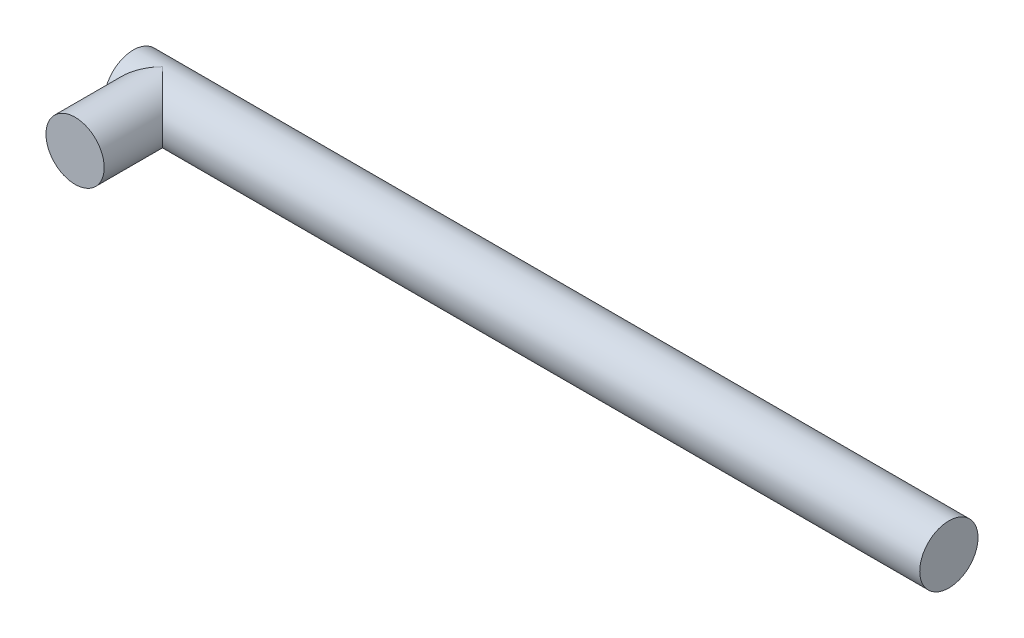
from build123d import *

# Parameters (mm, degrees)
SKETCH1_R           = 250
BOSS_EXTRUDE1_DEPTH = 7000
SKETCH2_R           = 250
BOSS_EXTRUDE2_DEPTH = 750


with BuildPart() as part:
    # Sketch1 → Boss-Extrude1 (new body)
    with BuildSketch(Plane(origin=(0, 0, 0), x_dir=(0, 0, -1), z_dir=(1, 0, 0))):
        Circle(SKETCH1_R)
    extrude(amount=BOSS_EXTRUDE1_DEPTH)

    # Sketch2 → Boss-Extrude2 (add)
    with BuildSketch(Plane.XY):
        with Locations((250, 0)):
            Circle(SKETCH2_R)
    extrude(amount=BOSS_EXTRUDE2_DEPTH)


solid = part.part
